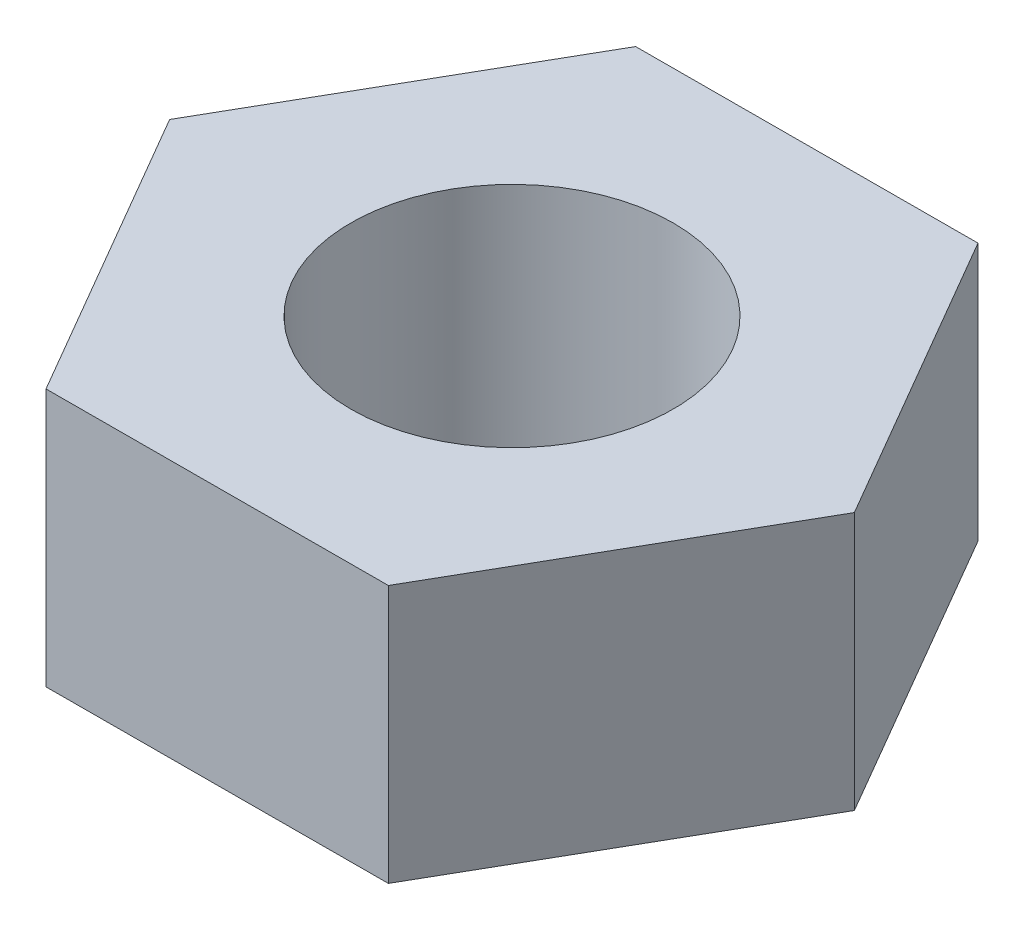
from build123d import *

# Parameters (mm, degrees)
SKETCH_1_R      = 1.5
EXTRUDE_1_DEPTH = 2.4


with BuildPart() as part:
    # 草图1 → 凸台-拉伸1 (new body)
    with BuildSketch(Plane(origin=(0, 0, 0), x_dir=(1, 0, 0), z_dir=(0, 1, 0))):
        Polygon((1.595543976, -2.745464032), (3.175413585, 0.0090496), (1.579869609, 2.754513632), (-1.595543976, 2.745464032), (-3.175413585, -0.0090496), (-1.579869609, -2.754513632), align=None)
        with Locations(Location((0, 0, 0), (0, 0, 270))):
            Circle(SKETCH_1_R, mode=Mode.SUBTRACT)
    extrude(amount=EXTRUDE_1_DEPTH)


solid = part.part
